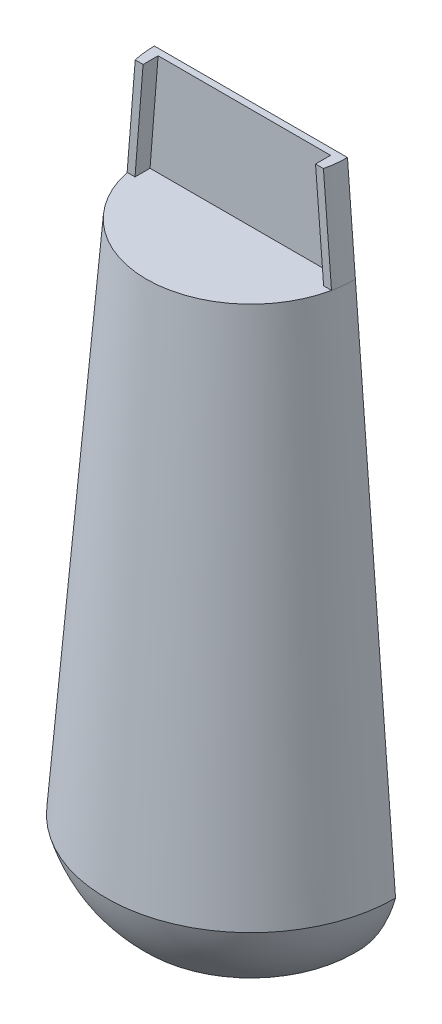
from build123d import *

# Parameters (mm, degrees)
REVOLVE1_ANGLE = 180


with BuildPart() as part:
    # Sketch1 → Revolve1 (revolve)
    with BuildSketch(Plane.XY):
        with BuildLine():
            Line((27.686, 0), (22.606, 0))
            Line((22.606, 0), (22.606, 1.8288))
            add(Edge.make_bspline(
                [(22.606, 1.8288), (25.041168082, 1.8288), (27.106875675, 2.820982452), (28.829, 4.191)],
                knots=[0, 0, 0, 0, 0.286842678, 0.286842678, 0.286842678, 0.286842678], degree=3))
            Line((28.829, 4.191), (22.606, 4.191))
            Line((22.606, 4.191), (22.606, 5.8928))
            Line((22.606, 5.8928), (30.607, 5.8928))
            add(Edge.make_bspline(
                [(30.607, 5.8928), (35.326430108, 11.240557446), (36.542913871, 18.669)],
                knots=[0.392904056, 0.392904056, 0.392904056, 1, 1, 1], degree=2))
            Line((36.542913871, 18.669), (0, 18.669))
            Line((0, 18.669), (0, 185.547))
            Line((0, 185.547), (26.0985, 185.547))
            Line((26.0985, 185.547), (39.0906, 18.669))
            add(Edge.make_bspline(
                [(27.686, 0), (33.019237831, 4.973324735), (36.732929961, 10.734198825), (39.0906, 18.669)],
                knots=[0, 0, 0, 0, 1, 1, 1, 1], degree=3))
        make_face()
    revolve(axis=Axis((0, 18.669, 0), (0, -1, 0)), revolution_arc=REVOLVE1_ANGLE)

    # Sketch2 for Cut-Loft1 → Cut-Loft1 section 0
    with BuildSketch(Plane(origin=(0, 185.547, 0), x_dir=(1, 0, 0), z_dir=(0, 1, 0))):
        with BuildLine():
            Line((-23.3045, -1.778), (23.3045, -1.778))
            Line((23.3045, -1.778), (23.3045, -5.842))
            Line((23.3045, -5.842), (25.43624851, -5.842))
            Line((25.43624851, -5.842), (28.03631071, -5.842))
            # circular arc as an exact rational Bezier (weights 1, cos(half-angle), 1)
            Bezier((28.03631071, -5.842), (0, -140.390907609), (-28.03631071, -5.842), weights=[1, 0.203991131, 1])
            Line((-28.03631071, -5.842), (-25.43624851, -5.842))
            Line((-25.43624851, -5.842), (-23.3045, -5.842))
            Line((-23.3045, -5.842), (-23.3045, -1.778))
        make_face()
    # Sketch4 for Cut-Loft1 → Cut-Loft1 section 1
    with BuildSketch(Plane(origin=(0, 158.115, 0), x_dir=(1, 0, 0), z_dir=(0, 1, 0))):
        with BuildLine():
            Line((-25.491437213, -1.778), (25.491437213, -1.778))
            Line((25.491437213, -1.778), (25.491437213, -5.842))
            Line((25.491437213, -5.842), (27.623185722, -5.842))
            Line((27.623185722, -5.842), (30.214593541, -5.842))
            Bezier((30.214593541, -5.842), (0, -162.110685865), (-30.214593541, -5.842), weights=[1, 0.189834418, 1])
            Line((-30.214593541, -5.842), (-27.623185722, -5.842))
            Line((-27.623185722, -5.842), (-25.491437213, -5.842))
            Line((-25.491437213, -5.842), (-25.491437213, -1.778))
        make_face()
    loft(mode=Mode.SUBTRACT)


solid = part.part
